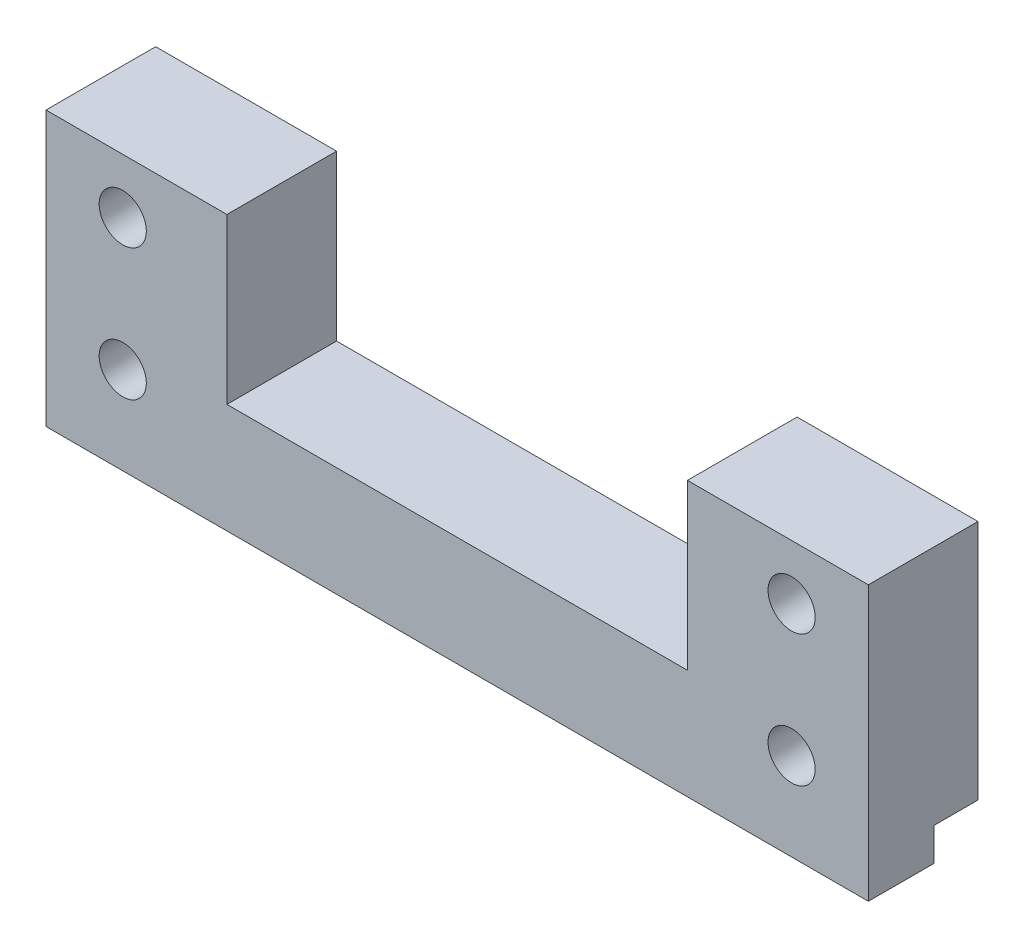
from build123d import *

# Parameters (mm, degrees)
SKETCH1_R           = 2.15
BOSS_EXTRUDE1_DEPTH = 10
SKETCH3_W           = 75
SKETCH3_H           = 3
CUT_EXTRUDE1_DEPTH  = 4


with BuildPart() as part:
    # Sketch1 → Boss-Extrude1 (new body)
    with BuildSketch(Plane.XY):
        Polygon((21, 5), (37.5, 5), (37.5, -20), (-37.5, -20), (-37.5, 5), (-21, 5), (-21, -10), (21, -10), align=None)
        with Locations((-30.5, 0)):
            Circle(SKETCH1_R, mode=Mode.SUBTRACT)
        with Locations((-30.5, -12)):
            Circle(SKETCH1_R, mode=Mode.SUBTRACT)
        with Locations((30.5, 0)):
            Circle(SKETCH1_R, mode=Mode.SUBTRACT)
        with Locations((30.5, -12)):
            Circle(SKETCH1_R, mode=Mode.SUBTRACT)
    extrude(amount=BOSS_EXTRUDE1_DEPTH)

    # Sketch3 → Cut-Extrude1 (cut)
    with BuildSketch(Plane(origin=(0, 0, 0), x_dir=(-1, 0, 0), z_dir=(0, 0, -1))):
        with Locations((0, -18.5)):
            Rectangle(SKETCH3_W, SKETCH3_H)
    extrude(amount=-CUT_EXTRUDE1_DEPTH, mode=Mode.SUBTRACT)


solid = part.part
